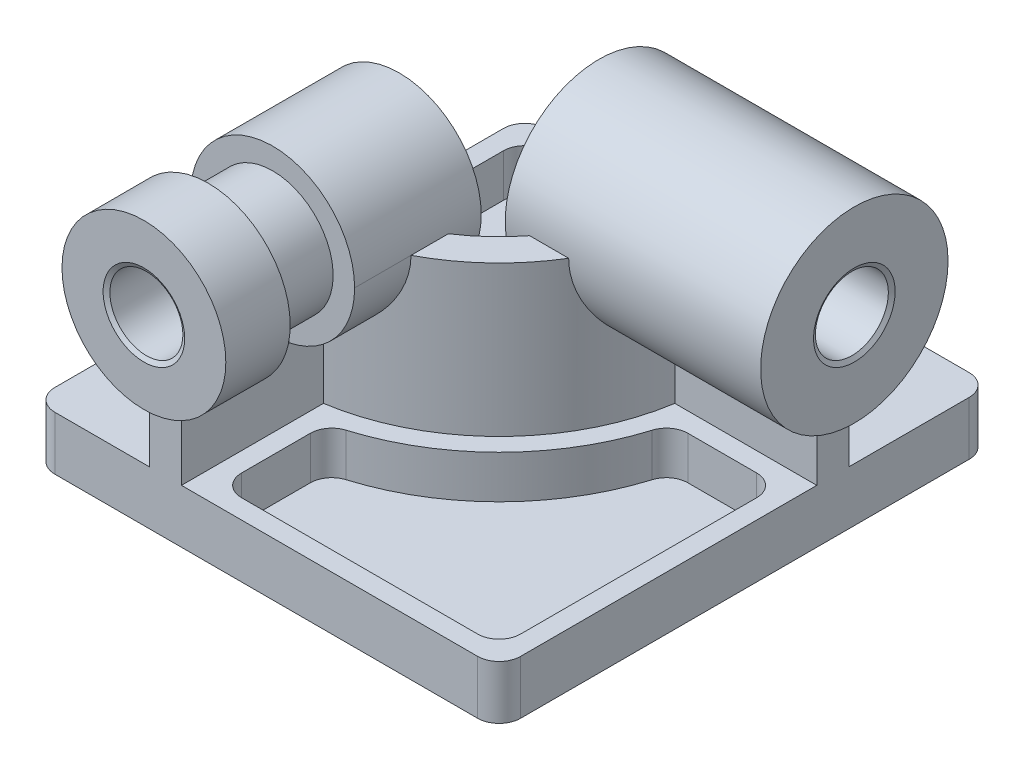
from build123d import *
from OCP.BRepFilletAPI import BRepFilletAPI_MakeChamfer

# Parameters (mm, degrees)
BOSS_EXTRUDE1_DEPTH = 25
BOSS_EXTRUDE2_START = -25
BOSS_EXTRUDE2_DEPTH = 95
BOSS_EXTRUDE4_START = 10
SKETCH7_R           = 38.166666667
BOSS_EXTRUDE4_DEPTH = 119
BOSS_EXTRUDE5_START = 10
SKETCH8_R           = 43.666666667
BOSS_EXTRUDE5_DEPTH = 119
CUT_EXTRUDE2_REACH  = 328.004
SKETCH9_R           = 17
CUT_EXTRUDE3_REACH  = 319.311
SKETCH10_R          = 17
CHAMFER1_SIZE       = 2
CHAMFER1_SIZE2      = 1.154700538
CUT_EXTRUDE4_START  = -30
CUT_EXTRUDE4_DEPTH  = 30
CUT_EXTRUDE5_DEPTH  = 20
CUT_EXTRUDE7_DEPTH  = 20


with BuildPart() as part:
    # Sketch1 → Boss-Extrude1 (new body)
    with BuildSketch(Plane(origin=(0, 0, 0), x_dir=(1, 0, 0), z_dir=(0, 1, 0))):
        with BuildLine():
            Line((-44, 66), (153, 66))
            ThreePointArc((153, 66), (160.071067812, 63.071067812), (163, 56))
            Line((163, 56), (163, -153))
            ThreePointArc((163, -153), (160.071067812, -160.071067812), (153, -163))
            Line((153, -163), (-44, -163))
            ThreePointArc((-44, -163), (-51.071067812, -160.071067812), (-54, -153))
            Line((-54, -153), (-54, 56))
            ThreePointArc((-54, 56), (-51.071067812, 63.071067812), (-44, 66))
        make_face()
    extrude(amount=BOSS_EXTRUDE1_DEPTH)

    # Sketch2 → Boss-Extrude2 (add)
    with BuildSketch(Plane(origin=(0, 25, 0), x_dir=(1, 0, 0), z_dir=(0, 1, 0)).offset(BOSS_EXTRUDE2_START)):
        with BuildLine():
            Line((0, -83), (0, -163))
            Line((0, -163), (15, -163))
            Line((15, -163), (15, -96.845237364))
            ThreePointArc((15, -96.845237364), (69.296464556, -69.296464556), (96.845237364, -15))
            Line((96.845237364, -15), (163, -15))
            Line((163, -15), (163, 0))
            Line((163, 0), (83, 0))
            ThreePointArc((83, 0), (58.689862838, -58.689862838), (0, -83))
        make_face()
    extrude(amount=BOSS_EXTRUDE2_DEPTH)

    # Sketch7 → Boss-Extrude4 (add)
    with BuildSketch(Plane.XY.offset(163).offset(BOSS_EXTRUDE4_START)):
        with Locations((7.5, 95)):
            Circle(SKETCH7_R)
    extrude(amount=-BOSS_EXTRUDE4_DEPTH)

    # Sketch8 → Boss-Extrude5 (add)
    with BuildSketch(Plane(origin=(163, 0, 0), x_dir=(0, 0, -1), z_dir=(1, 0, 0)).offset(BOSS_EXTRUDE5_START)):
        with Locations((-7.5, 95)):
            Circle(SKETCH8_R)
    extrude(amount=-BOSS_EXTRUDE5_DEPTH)

    # Sketch9 → Cut-Extrude2 (cut, up to next)
    with BuildSketch(Plane.XY.offset(173), mode=Mode.PRIVATE) as cut_extrude2_sk1:
        with Locations((7.5, 95)):
            Circle(SKETCH9_R)
    cut_extrude2_tool1 = extrude(cut_extrude2_sk1.sketch, amount=-CUT_EXTRUDE2_REACH, mode=Mode.PRIVATE) & part.part
    add(cut_extrude2_tool1.solids().sort_by_distance((7.5, 95, 173))[0], mode=Mode.SUBTRACT)

    # Sketch10 → Cut-Extrude3 (cut, up to next)
    with BuildSketch(Plane(origin=(173, 0, 0), x_dir=(0, 0, -1), z_dir=(1, 0, 0)), mode=Mode.PRIVATE) as cut_extrude3_sk1:
        with Locations((-7.5, 95)):
            Circle(SKETCH10_R)
    cut_extrude3_tool1 = extrude(cut_extrude3_sk1.sketch, amount=-CUT_EXTRUDE3_REACH, mode=Mode.PRIVATE) & part.part
    add(cut_extrude3_tool1.solids().sort_by_distance((173, 95, 7.5))[0], mode=Mode.SUBTRACT)

    # Chamfer1: one chamfer whose edges measure the first distance from different faces: ONE call of the kernel's chamfer builder (chamfer() names one face for all edges)
    chamfer1_edges_1 = [part.edges().sort_by_distance(p)[0] for p in [
        (-9.5, 95, 173),
    ]]
    chamfer1_side_1 = [part.faces().sort_by_distance(p)[0] for p in [
        (-29.587150314, 95, 173),
    ]]
    chamfer1_edges_2 = [part.edges().sort_by_distance(p)[0] for p in [
        (-9.5, 95, 54),
    ]]
    chamfer1_side_2 = [part.faces().sort_by_distance(p)[0] for p in [
        (-29.587150314, 95, 54),
    ]]
    chamfer1_edges_3 = [part.edges().sort_by_distance(p)[0] for p in [
        (173, 95, 24.5),
    ]]
    chamfer1_side_3 = [part.faces().sort_by_distance(p)[0] for p in [
        (173, 95, 49.931586822),
    ]]
    chamfer1_edges_4 = [part.edges().sort_by_distance(p)[0] for p in [
        (54, 95, 24.5),
    ]]
    chamfer1_side_4 = [part.faces().sort_by_distance(p)[0] for p in [
        (54, 95, 49.931586822),
    ]]
    chamfer1 = BRepFilletAPI_MakeChamfer(part.part.solid().wrapped)
    for e in chamfer1_edges_1:
        chamfer1.Add(CHAMFER1_SIZE, CHAMFER1_SIZE2, e.wrapped, chamfer1_side_1[0].wrapped)  # the first distance lies on this face
    for e in chamfer1_edges_2:
        chamfer1.Add(CHAMFER1_SIZE, CHAMFER1_SIZE2, e.wrapped, chamfer1_side_2[0].wrapped)  # the first distance lies on this face
    for e in chamfer1_edges_3:
        chamfer1.Add(CHAMFER1_SIZE, CHAMFER1_SIZE2, e.wrapped, chamfer1_side_3[0].wrapped)  # the first distance lies on this face
    for e in chamfer1_edges_4:
        chamfer1.Add(CHAMFER1_SIZE, CHAMFER1_SIZE2, e.wrapped, chamfer1_side_4[0].wrapped)  # the first distance lies on this face
    add(Compound.cast(chamfer1.Shape()), mode=Mode.REPLACE)

    # Sketch11 → Cut-Extrude4 (cut)
    with BuildSketch(Plane.XY.offset(173).offset(CUT_EXTRUDE4_START)):
        with BuildLine():
            Line((0, 57.577487465), (0, 67.850209741))
            ThreePointArc((0, 67.850209741), (7.5, 123.166666667), (15, 67.850209741))
            Line((15, 67.850209741), (15, 57.577487465))
            ThreePointArc((15, 57.577487465), (7.5, 133.166666667), (0, 57.577487465))
        make_face()
    extrude(amount=-CUT_EXTRUDE4_DEPTH, mode=Mode.SUBTRACT)

    # Sketch12 → Cut-Extrude5 (cut)
    with BuildSketch(Plane(origin=(0, 25, 0), x_dir=(1, 0, 0), z_dir=(0, 1, 0))):
        with BuildLine():
            Line((24, -111.950882087), (24, -144))
            ThreePointArc((24, -144), (26.928932188, -151.071067812), (34, -154))
            Line((34, -154), (144, -154))
            ThreePointArc((144, -154), (151.071067812, -151.071067812), (154, -144))
            Line((154, -144), (154, -34))
            ThreePointArc((154, -34), (151.071067812, -26.928932188), (144, -24))
            Line((144, -24), (111.950882087, -24))
            ThreePointArc((111.950882087, -24), (105.995205343, -25.966948617), (102.382430626, -31.094017094))
            ThreePointArc((102.382430626, -31.094017094), (75.660425587, -75.660425587), (31.094017094, -102.382430626))
            ThreePointArc((31.094017094, -102.382430626), (25.966948617, -105.995205343), (24, -111.950882087))
        make_face()
    extrude(amount=-CUT_EXTRUDE5_DEPTH, mode=Mode.SUBTRACT)

    # Sketch13 → Cut-Extrude7 (cut)
    with BuildSketch(Plane(origin=(0, 25, 0), x_dir=(1, 0, 0), z_dir=(0, 1, 0))):
        with BuildLine():
            Line((74, 0), (74, 47))
            ThreePointArc((74, 47), (71.071067812, 54.071067812), (64, 57))
            Line((64, 57), (-35, 57))
            ThreePointArc((-35, 57), (-42.071067812, 54.071067812), (-45, 47))
            Line((-45, 47), (-45, -64))
            ThreePointArc((-45, -64), (-42.071067812, -71.071067812), (-35, -74))
            Line((-35, -74), (0, -74))
            ThreePointArc((0, -74), (52.325901808, -52.325901808), (74, 0))
        make_face()
    extrude(amount=-CUT_EXTRUDE7_DEPTH, mode=Mode.SUBTRACT)


solid = part.part
